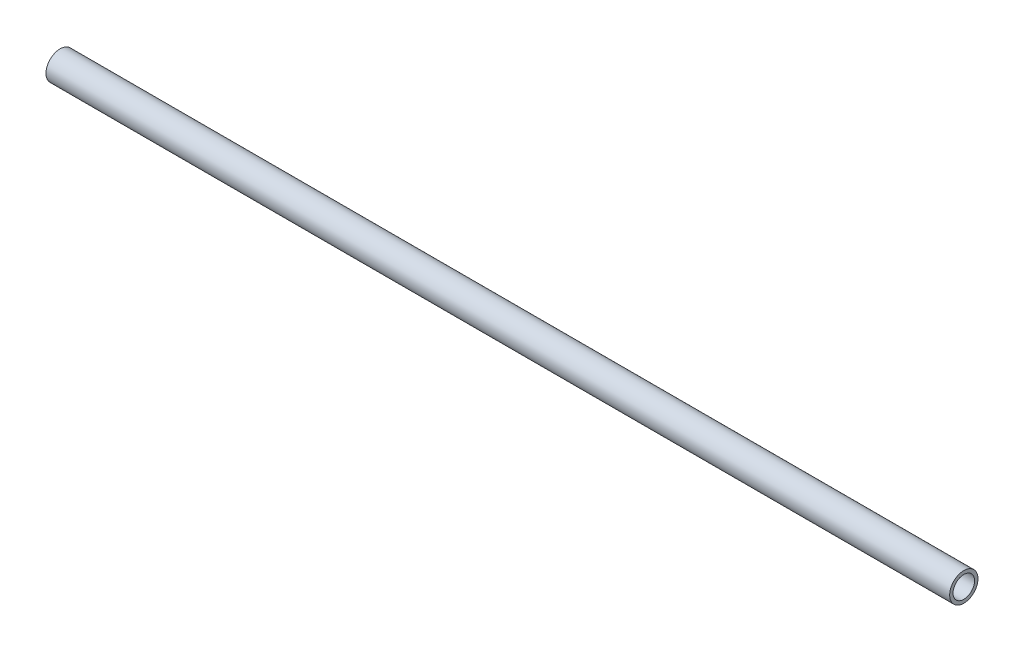
from build123d import *

# Parameters (mm, degrees)
SKETCH1_R           = 12.7
SKETCH1_R_2         = 9.652
BOSS_EXTRUDE1_DEPTH = 810


with BuildPart() as part:
    # Sketch1 → Boss-Extrude1 (new body)
    with BuildSketch(Plane(origin=(0, 0, 0), x_dir=(0, 0, -1), z_dir=(1, 0, 0))):
        Circle(SKETCH1_R)
        Circle(SKETCH1_R_2, mode=Mode.SUBTRACT)
    extrude(amount=BOSS_EXTRUDE1_DEPTH)


solid = part.part
